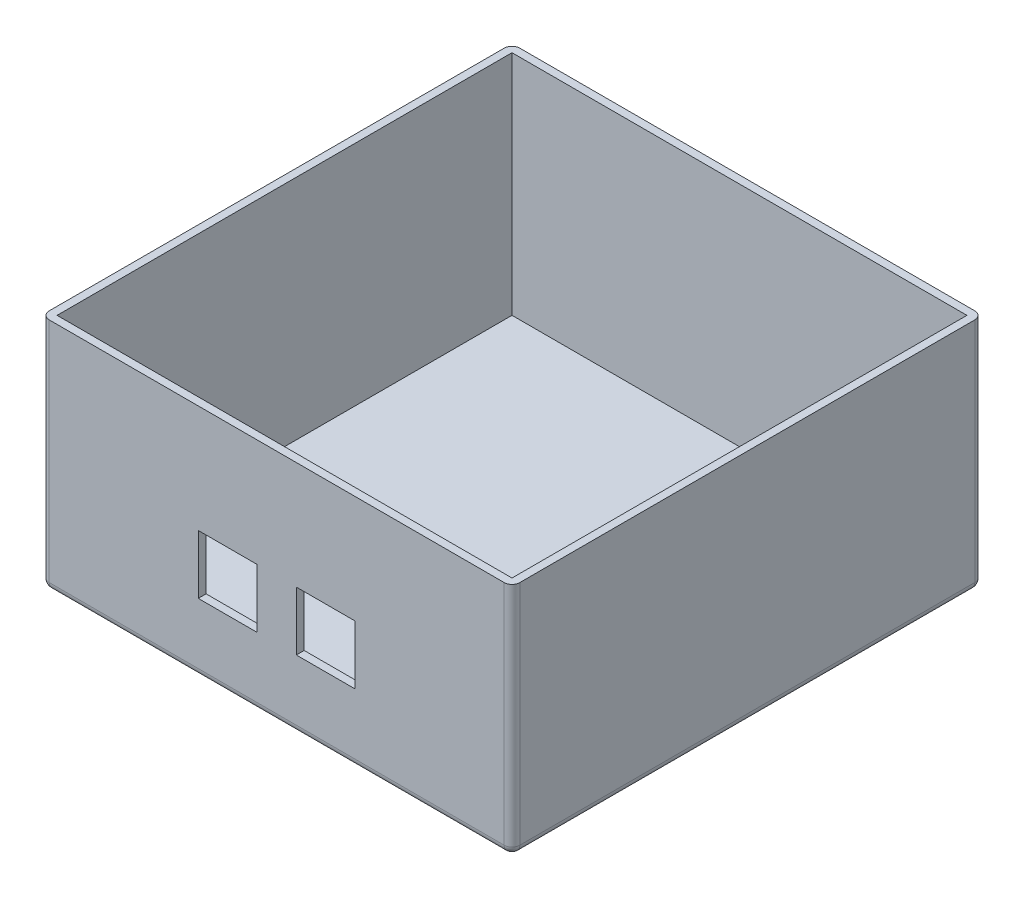
from build123d import *

# Parameters (mm, degrees)
SKETCH1_W           = 120
SKETCH1_H           = 120
BOSS_EXTRUDE1_DEPTH = 60
SHELL1_T            = -2
FILLET1_R           = 2
CUT_EXTRUDE1_REACH  = 148.969
SKETCH2_W           = 15
SKETCH2_H           = 15


with BuildPart() as part:
    # Sketch1 → Boss-Extrude1 (new body)
    with BuildSketch(Plane(origin=(0, 0, 0), x_dir=(1, 0, 0), z_dir=(0, 1, 0))):
        Rectangle(SKETCH1_W, SKETCH1_H)
    extrude(amount=BOSS_EXTRUDE1_DEPTH)

    # Shell1
    shell1_openings = [part.faces().sort_by_distance(p)[0] for p in [
        (0, 60, 0),
    ]]
    offset(amount=SHELL1_T, openings=shell1_openings, kind=Kind.INTERSECTION)

    # Fillet1
    fillet1_edges = [part.edges().sort_by_distance(p)[0] for p in [
        (0, 0, 60),
        (-60, 0, 0),
        (0, 0, -60),
        (60, 0, 0),
        (60, 30, 60),
        (-60, 30, 60),
        (-60, 30, -60),
        (60, 30, -60),
    ]]
    fillet(fillet1_edges, radius=FILLET1_R)

    # Sketch2 → Cut-Extrude1 (cut, up to next)
    with BuildSketch(Plane.XY.offset(60), mode=Mode.PRIVATE) as cut_extrude1_sk1:
        with Locations((-12.5, 25)):
            Rectangle(SKETCH2_W, SKETCH2_H)
    cut_extrude1_tool1 = extrude(cut_extrude1_sk1.sketch, amount=-CUT_EXTRUDE1_REACH, mode=Mode.PRIVATE) & part.part
    # Sketch2 → Cut-Extrude1 (cut, up to next)
    with BuildSketch(Plane.XY.offset(60), mode=Mode.PRIVATE) as cut_extrude1_sk2:
        with Locations((12.5, 25)):
            Rectangle(SKETCH2_W, SKETCH2_H)
    cut_extrude1_tool2 = extrude(cut_extrude1_sk2.sketch, amount=-CUT_EXTRUDE1_REACH, mode=Mode.PRIVATE) & part.part
    add(cut_extrude1_tool1.solids().sort_by_distance((-12.5, 25, 60))[0], mode=Mode.SUBTRACT)
    add(cut_extrude1_tool2.solids().sort_by_distance((12.5, 25, 60))[0], mode=Mode.SUBTRACT)


solid = part.part
